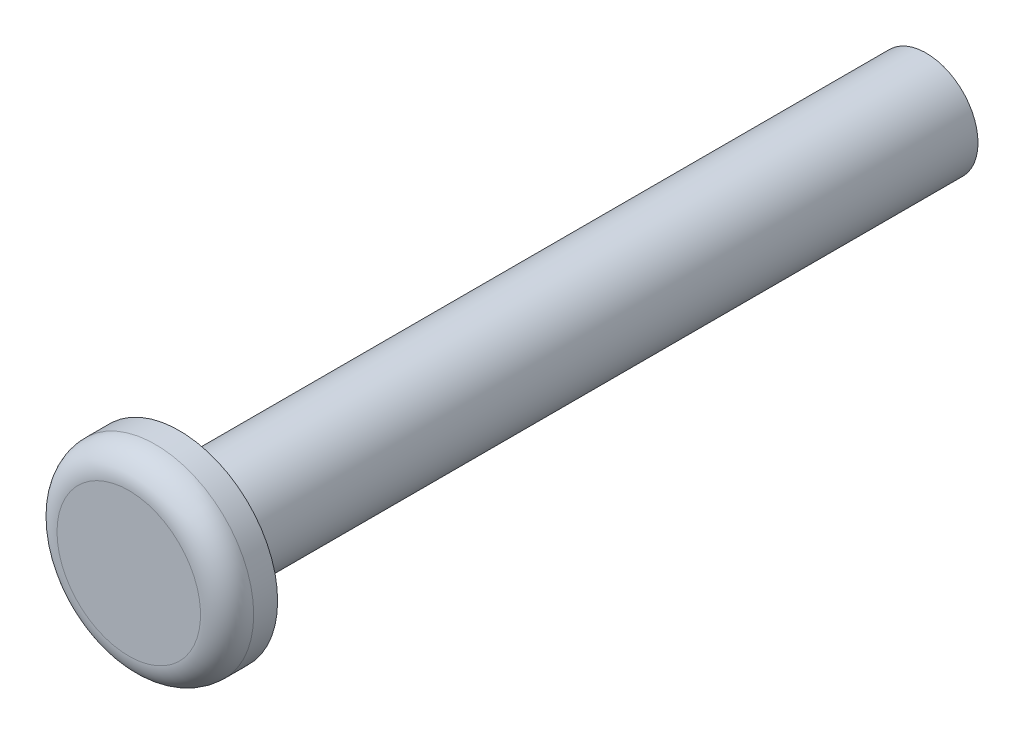
from build123d import *

# Parameters (mm, degrees)
FILLET1_R = 1


with BuildPart() as part:
    # Sketch1 → Revolve1 (revolve)
    with BuildSketch(Plane(origin=(0, 0, 0), x_dir=(0, 0, -1), z_dir=(1, 0, 0)), mode=Mode.PRIVATE) as revolve1_sk:
        Polygon((1.9, 1.95), (1.9, 3.7), (0, 3.7), (0, 0), (30, 0), (30, 1.95), align=None)
    revolve(revolve1_sk.sketch.rotate(Axis((0, 0, 0), (0, 0, -1)), 90), axis=Axis((0, 0, 0), (0, 0, -1)))

    # Fillet1
    fillet1_edges = [part.edges().sort_by_distance(p)[0] for p in [
        (-3.7, 0, 0),
    ]]
    fillet(fillet1_edges, radius=FILLET1_R)


solid = part.part
